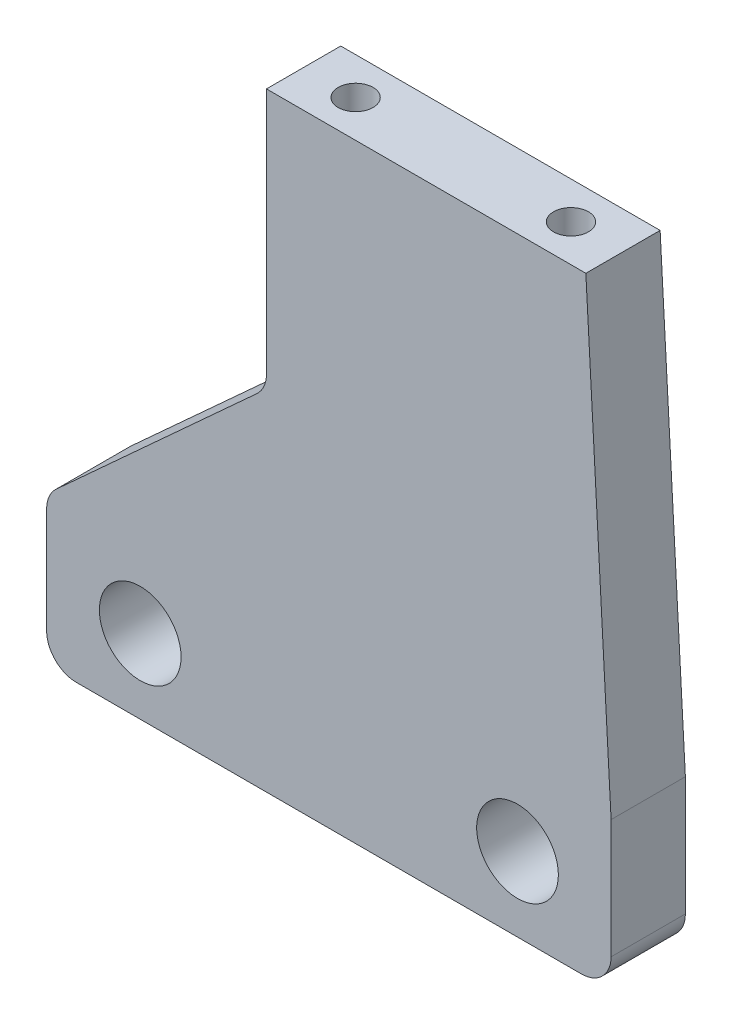
from build123d import *

# Parameters (mm, degrees)
SKETCH1_W           = 38
SKETCH1_H           = 10
BOSS_EXTRUDE1_DEPTH = 5
SKETCH2_R           = 2.75
CUT_EXTRUDE1_DEPTH  = 5
SKETCH3_W           = 21.5
SKETCH3_H           = 31
BOSS_EXTRUDE2_DEPTH = 5
BOSS_EXTRUDE6_DEPTH = 5
SKETCH10_R          = 1.175
CUT_EXTRUDE4_DEPTH  = 8
FILLET2_R           = 2
BOSS_EXTRUDE7_DEPTH = 5


with BuildPart() as part:
    # Sketch1 → Boss-Extrude1 (new body)
    with BuildSketch(Plane.XY):
        Rectangle(SKETCH1_W, SKETCH1_H)
    extrude(amount=BOSS_EXTRUDE1_DEPTH)

    # Sketch2 → Cut-Extrude1 (cut)
    with BuildSketch(Plane.XY.offset(5)):
        with Locations((-12.7, 0)):
            Circle(SKETCH2_R)
        with Locations((12.7, 0)):
            Circle(SKETCH2_R)
    extrude(amount=-CUT_EXTRUDE1_DEPTH, mode=Mode.SUBTRACT)

    # Sketch3 → Boss-Extrude2 (add)
    with BuildSketch(Plane.XY.offset(5)):
        with Locations((6.55, 20.5)):
            Rectangle(SKETCH3_W, SKETCH3_H)
    extrude(amount=-BOSS_EXTRUDE2_DEPTH)

    # Sketch8 → Boss-Extrude6 (add)
    with BuildSketch(Plane.XY.offset(5)):
        Polygon((-4.2, 5), (-19, 5), (-4.2, 18.5), align=None)
    extrude(amount=-BOSS_EXTRUDE6_DEPTH)

    # Sketch10 → Cut-Extrude4 (cut)
    with BuildSketch(Plane(origin=(0, 36, 0), x_dir=(1, 0, 0), z_dir=(0, 1, 0))):
        with Locations(Location((-0.7, -2.5, 0), (0, 0, 270))):
            Circle(SKETCH10_R)
        with Locations(Location((13.8, -2.5, 0), (0, 0, 270))):
            Circle(SKETCH10_R)
    extrude(amount=-CUT_EXTRUDE4_DEPTH, mode=Mode.SUBTRACT)

    # Fillet2
    fillet2_edges = [part.edges().sort_by_distance(p)[0] for p in [
        (-4.2, 18.5, 2.5),
        (19, -5, 2.5),
        (-19, -5, 2.5),
        (-19, 5, 2.5),
    ]]
    fillet(fillet2_edges, radius=FILLET2_R)

    # Sketch11 → Boss-Extrude7 (add)
    with BuildSketch(Plane.XY.offset(5)):
        Polygon((19, 5), (17.3, 36), (17.3, 5), align=None)
    extrude(amount=-BOSS_EXTRUDE7_DEPTH)


solid = part.part
